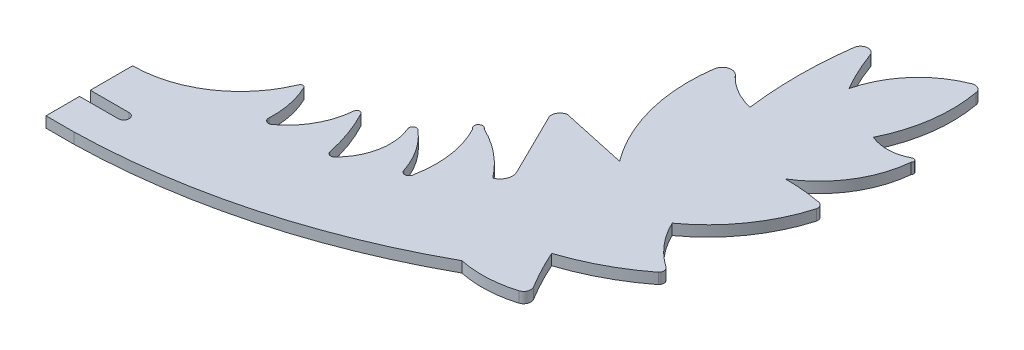
from build123d import *

# Parameters (mm, degrees)
BOSS_EXTRUDE1_DEPTH = 3


with BuildPart() as part:
    # Sketch1 → Boss-Extrude1 (new body)
    with BuildSketch(Plane(origin=(0, 0, 0), x_dir=(1, 0, 0), z_dir=(0, 1, 0))):
        with BuildLine():
            Line((-27.566533023, 9.36), (-27.566533023, 0))
            Line((-27.566533023, 0), (-19.823403694, 0))
            ThreePointArc((-19.823403694, 0), (24.20597109, 6.306968985), (65.433466977, 23))
            ThreePointArc((65.433466977, 23), (73.082886665, 22.390495512), (80.646880945, 23.683208869))
            ThreePointArc((80.646880945, 23.683208869), (81.946672363, 24.893615616), (81.784737476, 26.662321164))
            ThreePointArc((81.784737476, 26.662321164), (78.82438559, 31.885442154), (76.202135766, 37.28622747))
            ThreePointArc((76.202135766, 37.28622747), (86.37958616, 41.621825), (95.668579031, 47.629529544))
            ThreePointArc((95.668579031, 47.629529544), (96.113926531, 48.706505439), (95.666017221, 49.782418412))
            ThreePointArc((95.666017221, 49.782418412), (89.924608564, 54.937742393), (85.709789242, 61.401211803))
            ThreePointArc((85.709789242, 61.401211803), (96.000732533, 71.797200989), (102.357305132, 84.971952969))
            ThreePointArc((102.357305132, 84.971952969), (102.11128314, 86.223857216), (101.047487459, 86.928222044))
            ThreePointArc((101.047487459, 86.928222044), (95.950995205, 87.647987285), (90.808707622, 87.869738741))
            ThreePointArc((90.808707622, 87.869738741), (100.106213422, 97.05037675), (104.313081391, 109.420905852))
            ThreePointArc((104.313081391, 109.420905852), (104.396564886, 110.399625231), (103.439203659, 110.619444698))
            ThreePointArc((103.439203659, 110.619444698), (98.285170112, 109.227963636), (93.040390076, 110.224238556))
            ThreePointArc((93.040390076, 110.224238556), (96.824995658, 122.538102913), (96.530215503, 135.417062479))
            ThreePointArc((96.530215503, 135.417062479), (95.551508519, 136.778926007), (93.878347384, 136.893256429))
            ThreePointArc((93.878347384, 136.893256429), (83.613278323, 129.68205398), (77.858466896, 118.535071023))
            ThreePointArc((77.858466896, 118.535071023), (74.985694546, 124.095226744), (72.596248771, 129.879576449))
            ThreePointArc((72.596248771, 129.879576449), (70.378357546, 131.020039942), (68.639848531, 129.231944623))
            ThreePointArc((68.639848531, 129.231944623), (67.651272843, 114.747827583), (68.577278714, 100.25957574))
            ThreePointArc((68.577278714, 100.25957574), (63.407288288, 102.259220756), (59.026108144, 105.655195101))
            ThreePointArc((59.026108144, 105.655195101), (56.300849607, 106.738729111), (54.315586254, 104.580069929))
            ThreePointArc((54.315586254, 104.580069929), (55.34526323, 85.900059583), (63.427341461, 69.02750694))
            Line((63.427341461, 69.02750694), (44.822180162, 73.063888147))
            ThreePointArc((44.822180162, 73.063888147), (43.189327409, 72.023710618), (42.770208924, 70.133600278))
            Line((42.770208924, 70.133600278), (51.693414268, 52.061516653))
            ThreePointArc((51.693414268, 52.061516653), (51.807398335, 49.244580753), (49.792960169, 47.272232126))
            ThreePointArc((49.792960169, 47.272232126), (43.886083409, 53.379891607), (36.716738418, 57.940065925))
            ThreePointArc((36.716738418, 57.940065925), (34.842559279, 58.150522241), (35.17981611, 56.294963797))
            ThreePointArc((35.17981611, 56.294963797), (38.195000716, 47.026649531), (37.963262453, 37.282970301))
            ThreePointArc((37.963262453, 37.282970301), (36.915972263, 35.842205611), (35.471592941, 36.884504997))
            ThreePointArc((35.471592941, 36.884504997), (32.374331301, 43.249850807), (27.655103234, 48.526169922))
            ThreePointArc((27.655103234, 48.526169922), (26.369610718, 48.570167749), (26.028819046, 47.329890419))
            ThreePointArc((26.028819046, 47.329890419), (26.962894841, 38.326203111), (22.69935772, 30.341146196))
            ThreePointArc((22.69935772, 30.341146196), (21.519458622, 30.046407872), (20.701006485, 30.9459459))
            ThreePointArc((20.701006485, 30.9459459), (18.760748853, 37.885894085), (15.830732782, 44.469395153))
            ThreePointArc((15.830732782, 44.469395153), (14.897444009, 44.903650637), (14.219241967, 44.129281378))
            ThreePointArc((14.219241967, 44.129281378), (11.765539078, 35.905199886), (6.117654668, 29.443189676))
            ThreePointArc((6.117654668, 29.443189676), (4.728143423, 29.340639166), (4.041804517, 30.553155976))
            ThreePointArc((4.041804517, 30.553155976), (3.570156048, 36.827406443), (1.56510947, 42.791336307))
            ThreePointArc((1.56510947, 42.791336307), (0.867859685, 43.215318025), (0.196498979, 42.751429503))
            ThreePointArc((0.196498979, 42.751429503), (-10.860043289, 29.237113049), (-27.566533023, 24.16))
            Line((-27.566533023, 24.16), (-27.566533023, 12.36))
            Line((-27.566533023, 12.36), (-16.746533023, 12.36))
            ThreePointArc((-16.746533023, 12.36), (-15.246533023, 10.86), (-16.746533023, 9.36))
            Line((-16.746533023, 9.36), (-27.566533023, 9.36))
        make_face()
    extrude(amount=BOSS_EXTRUDE1_DEPTH)


solid = part.part
